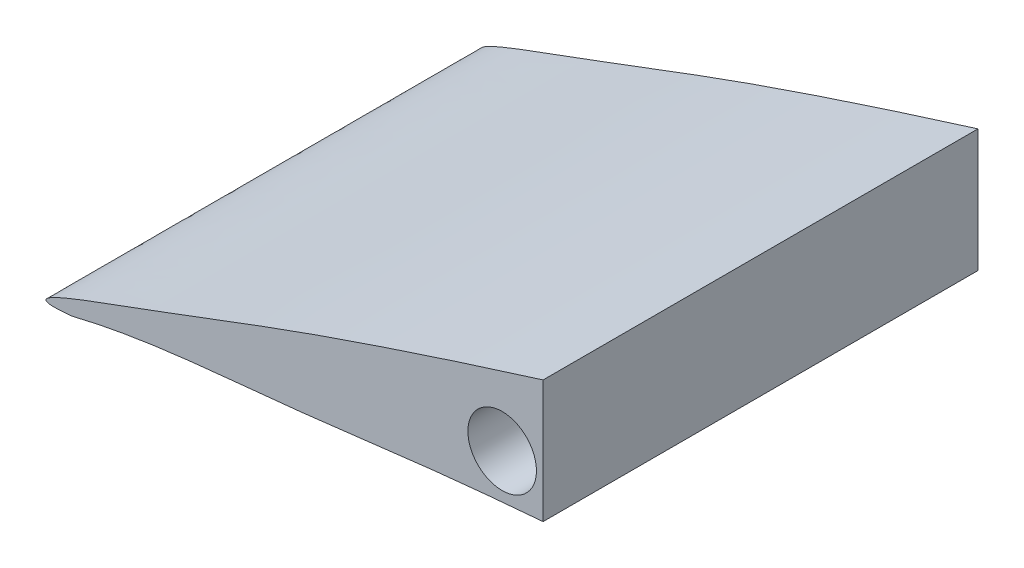
from build123d import *

# Parameters (mm, degrees)
SKETCH1_R           = 2.127
SKETCH1_R_2         = 2.032
BOSS_EXTRUDE1_DEPTH = 26.9875
SKETCH2_W           = 104.732489184
SKETCH2_H           = 32.948386637
CUT_EXTRUDE1_DEPTH  = 27.0764


with BuildPart() as part:
    # Sketch1 → Boss-Extrude1 (new body)
    with BuildSketch(Plane.XY):
        with BuildLine():
            Line((42.918297493, -0.447743106), (42.918297493, 8.263094686))
            ThreePointArc((42.918297493, 8.263094686), (40.994864427, 12.243356636), (36.681098599, 13.209536914))
            add(Edge.make_bspline(
                [(36.681098599, 13.209536914), (19.829765645, 9.267240013), (-2.073589943, 3.844068304), (-31.096466219, -5.545914493), (-39.316765165, -8.806631661), (-49.515556323, -12.495660485), (-45.77248955, -12.10685039)],
                knots=[0.118068853, 0.118068853, 0.118068853, 0.118068853, 0.630725311, 0.824213609, 0.940085477, 1, 1, 1, 1], degree=3))
            add(Edge.make_bspline(
                [(-45.77248955, -12.10685039), (-41.337443699, -10.999265489), (-33.831609628, -10.530043097), (-20.483498257, -8.707547198), (-8.873433654, -8.01917435), (11.524588595, -6.028171323), (26.067321973, -5.659784939), (37.895141959, -5.527425055)],
                knots=[0, 0, 0, 0, 0.144322392, 0.237947652, 0.42712275, 0.512831912, 0.887817721, 0.887817721, 0.887817721, 0.887817721], degree=3))
            ThreePointArc((37.895141959, -5.527425055), (41.450441586, -4.019691462), (42.918297493, -0.447743106))
        make_face()
        with Locations((-19.10248955, -6.01085039)):
            Circle(SKETCH1_R, mode=Mode.SUBTRACT)
        with Locations((12.64751045, 4.40314961)):
            Circle(SKETCH1_R, mode=Mode.SUBTRACT)
        with Locations((33.89346968, 3.421717851)):
            Circle(SKETCH1_R_2, mode=Mode.SUBTRACT)
    extrude(amount=BOSS_EXTRUDE1_DEPTH)

    # Sketch2 → Cut-Extrude1 (cut)
    with BuildSketch(Plane.XY.offset(26.9875)):
        with Locations((35.803755042, -2.355433399)):
            Rectangle(SKETCH2_W, SKETCH2_H)
    extrude(amount=-CUT_EXTRUDE1_DEPTH, mode=Mode.SUBTRACT)


solid = part.part
